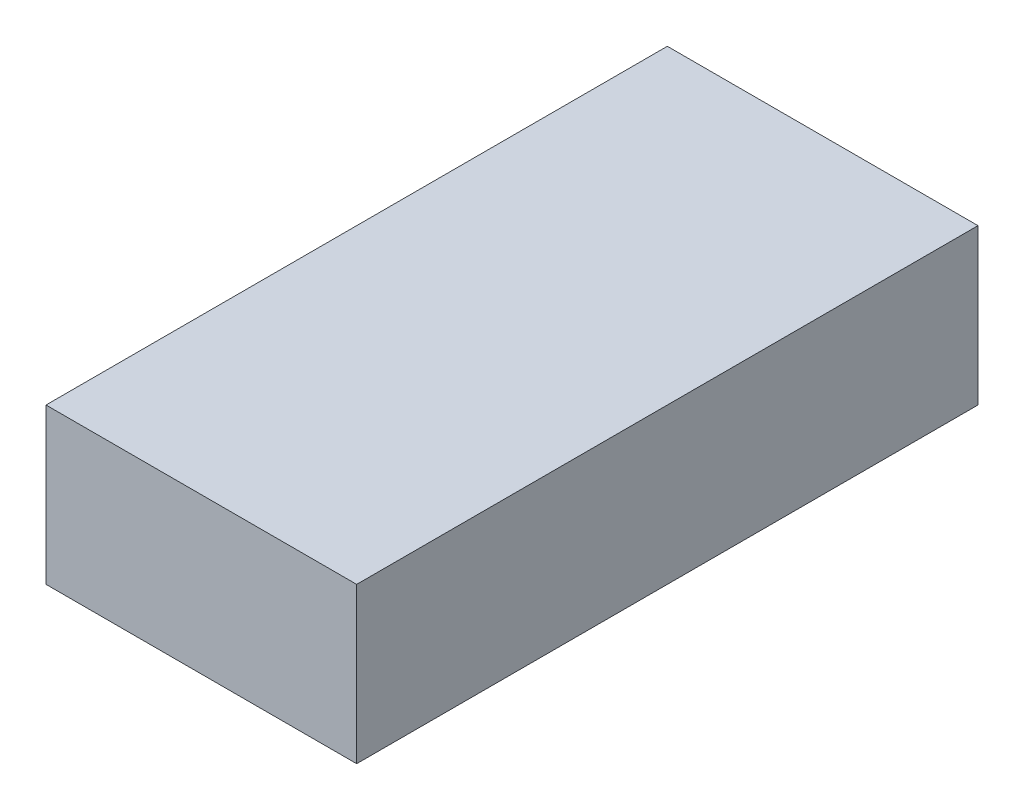
from build123d import *

# Parameters (mm, degrees)
CROQUIS1_W              = 50
CROQUIS1_H              = 100
SALIENTE_EXTRUIR1_DEPTH = 25


with BuildPart() as part:
    # Croquis1 → Saliente-Extruir1 (new body)
    with BuildSketch(Plane(origin=(0, 0, 0), x_dir=(1, 0, 0), z_dir=(0, 1, 0))):
        with Locations((25, 50)):
            Rectangle(CROQUIS1_W, CROQUIS1_H)
    extrude(amount=SALIENTE_EXTRUIR1_DEPTH)


solid = part.part
